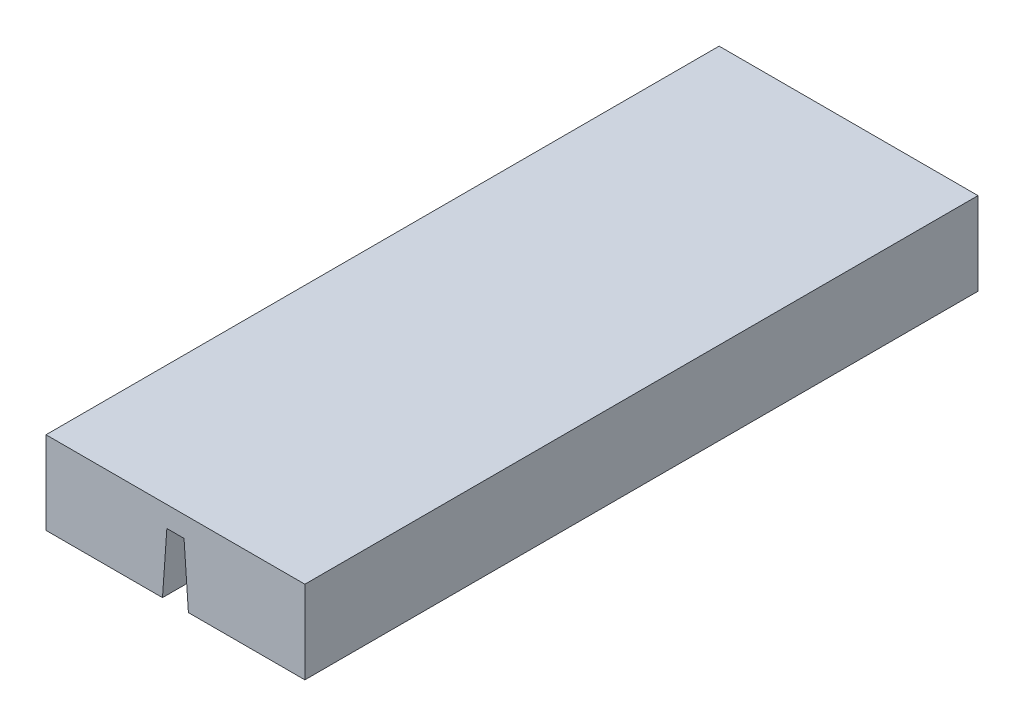
from build123d import *

# Parameters (mm, degrees)
SKETCH1_W           = 50
SKETCH1_H           = 130
BOSS_EXTRUDE1_DEPTH = 16
CUT_EXTRUDE1_DEPTH  = 167


with BuildPart() as part:
    # Sketch1 → Boss-Extrude1 (new body)
    with BuildSketch(Plane(origin=(0, 0, 0), x_dir=(1, 0, 0), z_dir=(0, 1, 0))):
        with Locations((25, -65)):
            Rectangle(SKETCH1_W, SKETCH1_H)
    extrude(amount=BOSS_EXTRUDE1_DEPTH)

    # Sketch3 → Cut-Extrude1 (cut)
    with BuildSketch(Plane.XY.offset(130)):
        Polygon((22.5, 0), (27.5, 0), (26.661208671, 11.995274858), (23.338791329, 11.995274858), align=None)
    extrude(amount=-CUT_EXTRUDE1_DEPTH, mode=Mode.SUBTRACT)


solid = part.part
